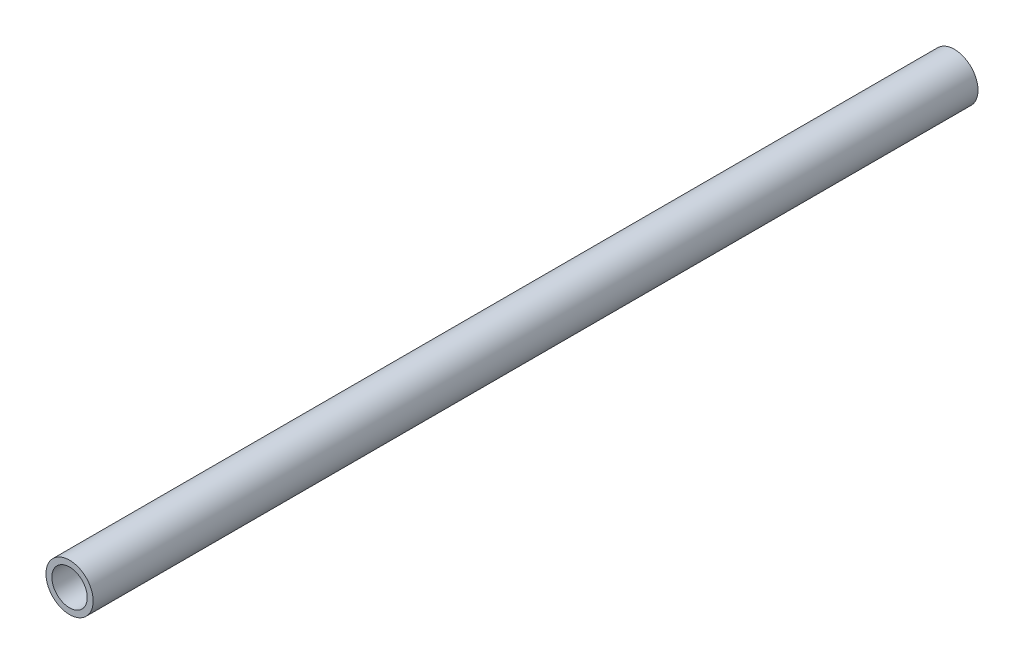
from build123d import *

# Parameters (mm, degrees)
SKETCH1_R           = 4
SKETCH1_R_2         = 3
BOSS_EXTRUDE1_DEPTH = 150


with BuildPart() as part:
    # Sketch1 → Boss-Extrude1 (new body)
    with BuildSketch(Plane.XY):
        Circle(SKETCH1_R)
        Circle(SKETCH1_R_2, mode=Mode.SUBTRACT)
    extrude(amount=BOSS_EXTRUDE1_DEPTH)


solid = part.part
